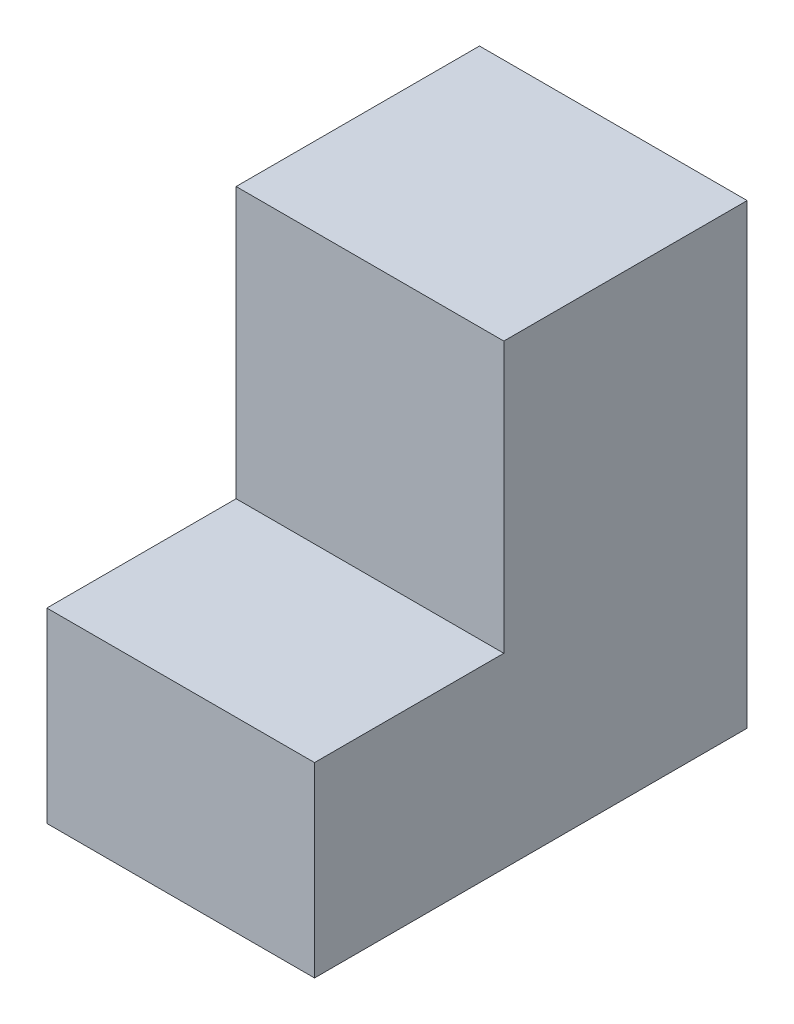
from build123d import *

# Parameters (mm, degrees)
SKETCH1_W           = 9.9
SKETCH1_H           = 6.9
BOSS_EXTRUDE1_DEPTH = 16
SKETCH2_W           = 9.9
SKETCH2_H           = 9
BOSS_EXTRUDE2_DEPTH = 10
SKETCH3_R           = 1.5
BOSS_EXTRUDE3_DEPTH = 3


with BuildPart() as part:
    # Sketch1 → Boss-Extrude1 (new body)
    with BuildSketch(Plane.XY):
        Rectangle(SKETCH1_W, SKETCH1_H)
    extrude(amount=BOSS_EXTRUDE1_DEPTH)

    # Sketch2 → Boss-Extrude2 (add)
    with BuildSketch(Plane(origin=(0, 3.45, 0), x_dir=(1, 0, 0), z_dir=(0, 1, 0))):
        with Locations((0, -4.5)):
            Rectangle(SKETCH2_W, SKETCH2_H)
    extrude(amount=BOSS_EXTRUDE2_DEPTH)

    # Sketch3 → Boss-Extrude3 (add)
    with BuildSketch(Plane(origin=(0, 0, 0), x_dir=(-1, 0, 0), z_dir=(0, 0, -1))):
        Circle(SKETCH3_R)
    extrude(amount=BOSS_EXTRUDE3_DEPTH)


solid = part.part
